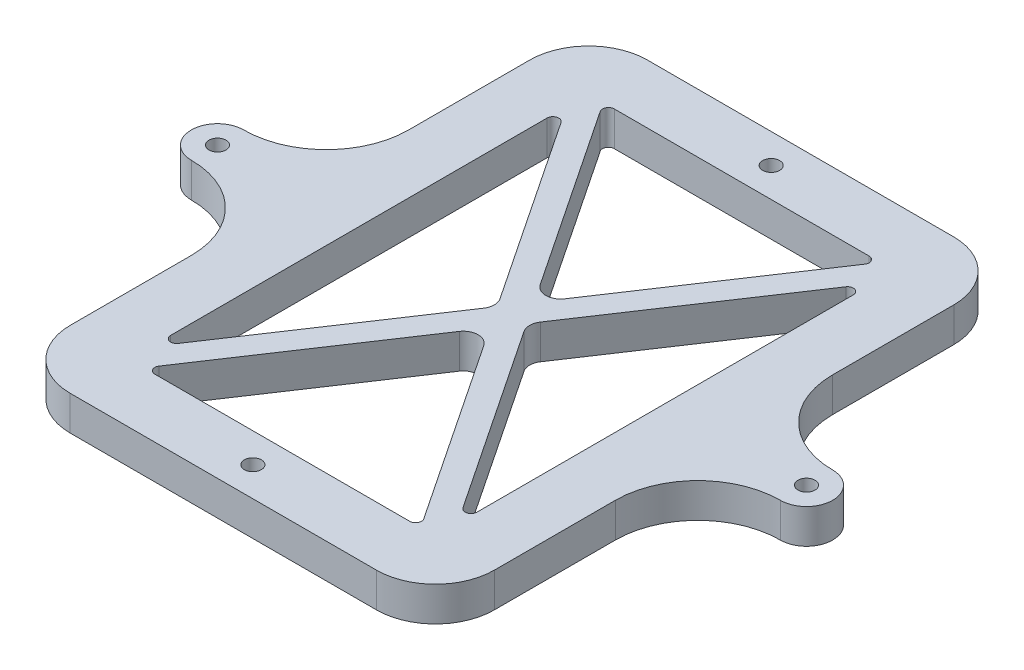
from build123d import *

# Parameters (mm, degrees)
SKETCH1_R           = 1.45
BOSS_EXTRUDE1_DEPTH = 5.85
FILLET1_R           = 1
FILLET2_R           = 2.5


with BuildPart() as part:
    # Sketch1 → Boss-Extrude1 (new body)
    with BuildSketch(Plane(origin=(0, 0, 0), x_dir=(1, 0, 0), z_dir=(0, 1, 0))):
        with BuildLine():
            ThreePointArc((-26, 49), (-33.071067812, 46.071067812), (-36, 39))
            Line((-36, 39), (-36, 18.45))
            ThreePointArc((-36, 18.45), (-40.100505063, 8.550505063), (-50, 4.45))
            ThreePointArc((-50, 4.45), (-54.45, 0), (-50, -4.45))
            ThreePointArc((-50, -4.45), (-40.100505063, -8.550505063), (-36, -18.45))
            Line((-36, -18.45), (-36, -39))
            ThreePointArc((-36, -39), (-33.071067812, -46.071067812), (-26, -49))
            Line((-26, -49), (26, -49))
            ThreePointArc((26, -49), (33.071067812, -46.071067812), (36, -39))
            Line((36, -39), (36, -18.45))
            ThreePointArc((36, -18.45), (40.100505063, -8.550505063), (50, -4.45))
            ThreePointArc((50, -4.45), (54.45, 0), (50, 4.45))
            ThreePointArc((50, 4.45), (40.100505063, 8.550505063), (36, 18.45))
            Line((36, 18.45), (36, 39))
            ThreePointArc((36, 39), (33.071067812, 46.071067812), (26, 49))
            Line((26, 49), (-26, 49))
        make_face()
        Polygon((-23.5, -39), (0, -3.75), (23.5, -39), align=None, mode=Mode.SUBTRACT)
        Polygon((26, -35.25), (2.5, 0), (26, 35.25), align=None, mode=Mode.SUBTRACT)
        Polygon((23.5, 39), (0, 3.75), (-23.5, 39), align=None, mode=Mode.SUBTRACT)
        Polygon((-26, 35.25), (-2.5, 0), (-26, -35.25), align=None, mode=Mode.SUBTRACT)
        with Locations(Location((-50, 0, 0), (0, 0, 270))):
            Circle(SKETCH1_R, mode=Mode.SUBTRACT)
        with Locations(Location((0, 44, 0), (0, 0, 270))):
            Circle(SKETCH1_R, mode=Mode.SUBTRACT)
        with Locations(Location((50, 0, 0), (0, 0, 270))):
            Circle(SKETCH1_R, mode=Mode.SUBTRACT)
        with Locations(Location((0, -44, 0), (0, 0, 270))):
            Circle(SKETCH1_R, mode=Mode.SUBTRACT)
    extrude(amount=BOSS_EXTRUDE1_DEPTH)

    # Fillet1
    fillet1_edges = [part.edges().sort_by_distance(p)[0] for p in [
        (-23.5, 2.925, 39),
        (23.5, 2.925, 39),
        (23.5, 2.925, -39),
        (-23.5, 2.925, -39),
        (26, 2.925, 35.25),
        (26, 2.925, -35.25),
        (-26, 2.925, -35.25),
        (-26, 2.925, 35.25),
    ]]
    fillet(fillet1_edges, radius=FILLET1_R)

    # Fillet2
    fillet2_edges = [part.edges().sort_by_distance(p)[0] for p in [
        (0, 2.925, 3.75),
        (0, 2.925, -3.75),
        (2.5, 2.925, 0),
        (-2.5, 2.925, 0),
    ]]
    fillet(fillet2_edges, radius=FILLET2_R)


solid = part.part
